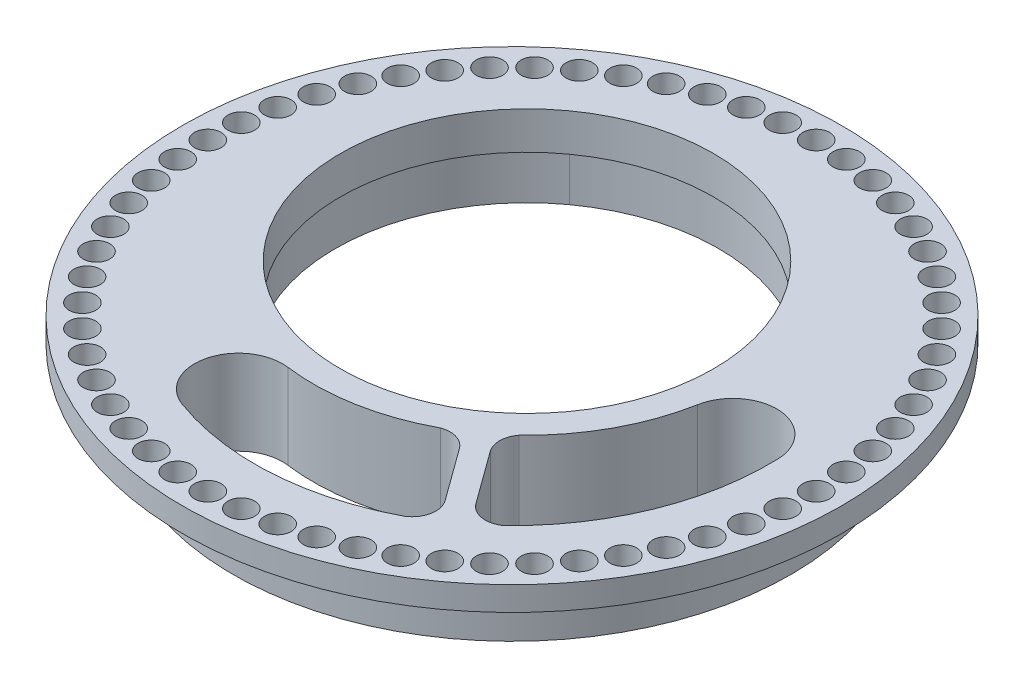
from build123d import *

# Parameters (mm, degrees)
SKETCH1_R                       = 61.9125
SKETCH1_R_2                     = 35.052
BOSS_EXTRUDE1_DEPTH             = 4.5212
SKETCH3_R                       = 52.3875
BOSS_EXTRUDE2_DEPTH             = 11.43
SKETCH4_R                       = 35.052
CUT_EXTRUDE1_DEPTH              = 89.998629731
SKETCH9_R                       = 36.000000009
CUT_EXTRUDE3_DEPTH              = 8.89
F_5_0MM_DOWEL_HOLE1_D           = 5
F_5_0MM_DOWEL_HOLE1_CSINK_D     = 5.05
F_5_0MM_DOWEL_HOLE1_CSINK_ANGLE = 90
CIRPATTERN1_COUNT               = 60
CUT_EXTRUDE5_DEPTH              = 89.998629731
BOSS_EXTRUDE3_REACH             = 89.92
BOSS_EXTRUDE3_DIRECTION_2_REACH = 89.92
BODY_MOVE_COPY1_ANGLE           = 180


with BuildPart() as part:
    # Sketch1 → Boss-Extrude1 (new body)
    with BuildSketch(Plane(origin=(0, 0, 0), x_dir=(1, 0, 0), z_dir=(0, 1, 0))):
        with Locations(Location((0, 0, 0), (0, 0, 270))):
            Circle(SKETCH1_R)
        with Locations(Location((0, -12.7, 0), (0, 0, 270))):
            Circle(SKETCH1_R_2, mode=Mode.SUBTRACT)
    extrude(amount=BOSS_EXTRUDE1_DEPTH)

    # Sketch3 → Boss-Extrude2 (add)
    with BuildSketch(Plane(origin=(0, 4.5212, 0), x_dir=(1, 0, 0), z_dir=(0, 1, 0))):
        with Locations(Location((0, 0, 0), (0, 0, 270))):
            Circle(SKETCH3_R)
    extrude(amount=BOSS_EXTRUDE2_DEPTH)

    # Sketch4 → Cut-Extrude1 (cut, through all)
    with BuildSketch(Plane.XZ):
        with Locations(Location((0, 12.7, 0), (0, 0, 270))):
            Circle(SKETCH4_R)
    extrude(amount=-CUT_EXTRUDE1_DEPTH, mode=Mode.SUBTRACT)

    # Sketch9 → Cut-Extrude3 (cut)
    with BuildSketch(Plane(origin=(0, 15.9512, 0), x_dir=(1, 0, 0), z_dir=(0, 1, 0))):
        with Locations(Location((0, -12.7, 0), (0, 0, 270))):
            Circle(SKETCH9_R)
    extrude(amount=-CUT_EXTRUDE3_DEPTH, mode=Mode.SUBTRACT)

    # Ø5.0mm Dowel Hole1 (through all)
    with Locations(Plane(origin=(0, 4.5212, 0), x_dir=(1, 0, 0), z_dir=(0, 1, 0))):
        with Locations((0, 57.15)):
            f_5_0mm_dowel_hole1 = CounterSinkHole(F_5_0MM_DOWEL_HOLE1_D / 2, F_5_0MM_DOWEL_HOLE1_CSINK_D / 2, counter_sink_angle=F_5_0MM_DOWEL_HOLE1_CSINK_ANGLE)

    # CirPattern1: Ø5.0mm Dowel Hole1 ×60 about axis
    cirpattern1_axis = Axis((0, 0, 0), (0, 1, 0))
    for i in range(1, CIRPATTERN1_COUNT):
        add(f_5_0mm_dowel_hole1.rotate(cirpattern1_axis, i * 360 / CIRPATTERN1_COUNT), mode=Mode.SUBTRACT)

    # Sketch10 → Cut-Extrude5 (cut, through all)
    with BuildSketch(Plane(origin=(0, 15.9512, 0), x_dir=(1, 0, 0), z_dir=(0, 1, 0))):
        with BuildLine():
            ThreePointArc((-27.568698422, 16.370448294), (0, 27.364000009), (27.568698422, 16.370448294))
            ThreePointArc((27.568698422, 16.370448294), (38.57955057, 16.056999754), (40.099152196, 26.966991775))
            ThreePointArc((40.099152196, 26.966991775), (0, 48.3235), (-40.099152196, 26.966991775))
            ThreePointArc((-40.099152196, 26.966991775), (-38.57955057, 16.056999754), (-27.568698422, 16.370448294))
        make_face()
    extrude(amount=-CUT_EXTRUDE5_DEPTH, mode=Mode.SUBTRACT)

    # Boss-Extrude3: up to this face of the body (flat: up to its plane)
    boss_extrude3_end = Plane(part.part.faces().sort_by_distance((0, 15.9512, -50.90575774))[0])
    # Sketch15 → Boss-Extrude3 (add, up to the picked face)
    with BuildSketch(Plane(origin=(0, 7.9756, 0), x_dir=(1, 0, 0), z_dir=(0, 1, 0)), mode=Mode.PRIVATE) as boss_extrude3_sk1:
        with BuildLine():
            ThreePointArc((2.032, 31.29096677), (2.926793499, 28.616259533), (5.250924096, 27.018407481))
            ThreePointArc((5.250924096, 27.018407481), (-0.056014781, 27.363960851), (-5.361966653, 27.003569239))
            ThreePointArc((-5.361966653, 27.003569239), (-3.020045747, 28.598028587), (-2.11713302, 31.283478782))
            Line((-2.11713302, 31.283478782), (-2.11713302, 43.39578959))
            ThreePointArc((-2.11713302, 43.39578959), (-3.543125847, 46.658245825), (-6.906163701, 47.827456081))
            ThreePointArc((-6.906163701, 47.827456081), (-0.203176512, 48.32307287), (6.503741299, 47.883838624))
            ThreePointArc((6.503741299, 47.883838624), (3.343379097, 46.591449005), (2.032, 43.438919063))
            Line((2.032, 43.438919063), (2.032, 31.29096677))
        make_face()
    boss_extrude3_tool1 = split(extrude(boss_extrude3_sk1.sketch, amount=BOSS_EXTRUDE3_REACH, mode=Mode.PRIVATE), bisect_by=boss_extrude3_end, keep=Keep.BOTH, mode=Mode.PRIVATE)
    add(boss_extrude3_tool1.solids().sort_by(Axis((-0.049426, 7.9756, -38.213586), (0, 1, 0)))[0])

    # Boss-Extrude3 direction 2: up to this face of the body (flat: up to its plane)
    boss_extrude3_direction_2_end = Plane(part.part.faces().sort_by_distance((0, 0, -60.161350056))[0])
    # Sketch15 → Boss-Extrude3 direction 2 (add, up to the picked face)
    with BuildSketch(Plane(origin=(0, 7.9756, 0), x_dir=(1, 0, 0), z_dir=(0, 1, 0)), mode=Mode.PRIVATE) as boss_extrude3_direction_2_sk1:
        with BuildLine():
            ThreePointArc((2.032, 31.29096677), (2.926793499, 28.616259533), (5.250924096, 27.018407481))
            ThreePointArc((5.250924096, 27.018407481), (-0.056014781, 27.363960851), (-5.361966653, 27.003569239))
            ThreePointArc((-5.361966653, 27.003569239), (-3.020045747, 28.598028587), (-2.11713302, 31.283478782))
            Line((-2.11713302, 31.283478782), (-2.11713302, 43.39578959))
            ThreePointArc((-2.11713302, 43.39578959), (-3.543125847, 46.658245825), (-6.906163701, 47.827456081))
            ThreePointArc((-6.906163701, 47.827456081), (-0.203176512, 48.32307287), (6.503741299, 47.883838624))
            ThreePointArc((6.503741299, 47.883838624), (3.343379097, 46.591449005), (2.032, 43.438919063))
            Line((2.032, 43.438919063), (2.032, 31.29096677))
        make_face()
    boss_extrude3_direction_2_tool1 = split(extrude(boss_extrude3_direction_2_sk1.sketch, amount=-BOSS_EXTRUDE3_DIRECTION_2_REACH, mode=Mode.PRIVATE), bisect_by=boss_extrude3_direction_2_end, keep=Keep.BOTH, mode=Mode.PRIVATE)
    add(boss_extrude3_direction_2_tool1.solids().sort_by(Axis((-0.049426, 7.9756, -38.213586), (0, -1, 0)))[0])


with BuildPart() as part_1:
    # Body-Move/Copy1: moved
    add(part.part.rotate(Axis((0, 0, 0), (0.9510565162951563, -3.671160734426369e-15, -0.3090169943749389)), BODY_MOVE_COPY1_ANGLE))


solid = part_1.part
